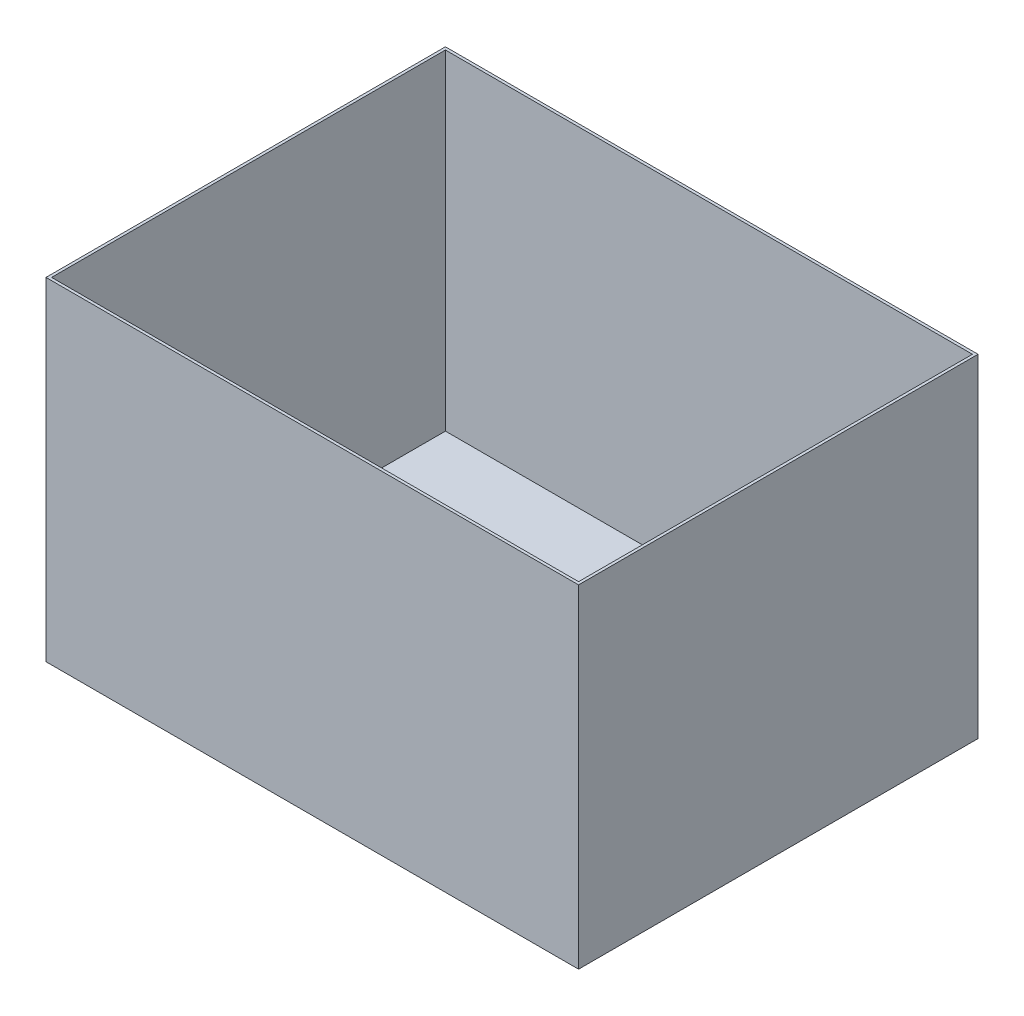
from build123d import *

# Parameters (mm, degrees)
SKETCH1_W           = 1219.2
SKETCH1_H           = 914.4
BOSS_EXTRUDE1_DEPTH = 762
SHELL1_T            = -6.35


with BuildPart() as part:
    # Sketch1 → Boss-Extrude1 (new body)
    with BuildSketch(Plane(origin=(0, 0, 0), x_dir=(1, 0, 0), z_dir=(0, 1, 0))):
        Rectangle(SKETCH1_W, SKETCH1_H)
    extrude(amount=BOSS_EXTRUDE1_DEPTH)

    # Shell1
    shell1_openings = [part.faces().sort_by_distance(p)[0] for p in [
        (0, 762, 0),
    ]]
    offset(amount=SHELL1_T, openings=shell1_openings, kind=Kind.INTERSECTION)


solid = part.part
